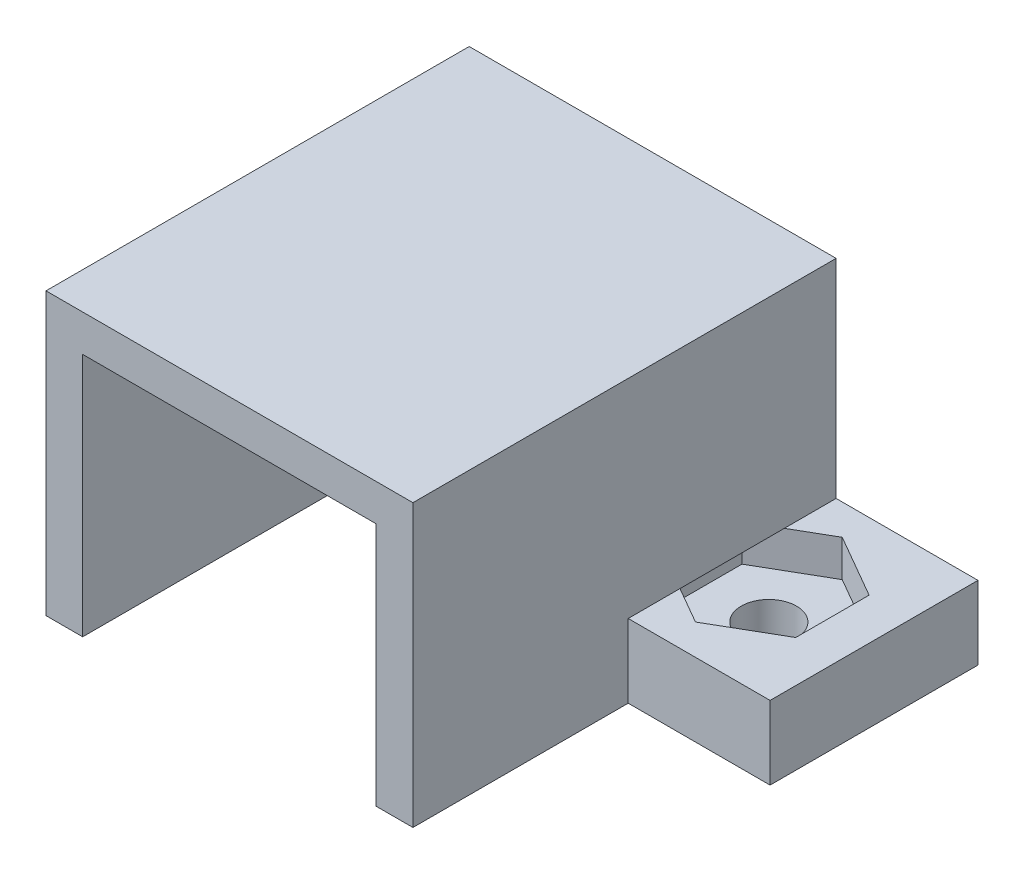
from build123d import *

# Parameters (mm, degrees)
BOSS_EXTRUDE4_DEPTH = 8.5
BOSS_EXTRUDE5_DEPTH = 8.8
CUT_EXTRUDE1_DEPTH  = 1.5
CUT_EXTRUDE2_REACH  = 35.269
SKETCH7_R           = 1.1303


with BuildPart() as part:
    # Sketch4 → Boss-Extrude4 (new body)
    with BuildSketch(Plane.XY):
        Polygon((0, 0), (0, 3), (5.8, 3), (5.8, 11.5), (20.8, 11.5), (20.8, 3), (26.6, 3), (26.6, 0), (19.3, 0), (19.3, 10), (7.3, 10), (7.3, 0), align=None)
    extrude(amount=BOSS_EXTRUDE4_DEPTH)

    # Sketch5 → Boss-Extrude5 (add)
    with BuildSketch(Plane.XY.offset(8.5)):
        Polygon((7.3, 0), (7.3, 10), (19.3, 10), (19.3, 0), (20.8, 0), (20.8, 11.5), (5.8, 11.5), (5.8, 0), align=None)
    extrude(amount=BOSS_EXTRUDE5_DEPTH)

    # Sketch6 → Cut-Extrude1 (cut)
    with BuildSketch(Plane(origin=(0, 3, 0), x_dir=(1, 0, 0), z_dir=(0, 1, 0))):
        Polygon((24.898076211, -5.75), (22.3, -7.25), (19.701923789, -5.75), (19.701923789, -2.75), (22.3, -1.25), (24.898076211, -2.75), align=None)
        Polygon((4.3, -7.25), (6.898076211, -5.75), (6.898076211, -2.75), (4.3, -1.25), (1.701923789, -2.75), (1.701923789, -5.75), align=None)
    extrude(amount=-CUT_EXTRUDE1_DEPTH, mode=Mode.SUBTRACT)

    # Sketch7 → Cut-Extrude2 (cut, up to next)
    with BuildSketch(Plane(origin=(0, 1.5, 0), x_dir=(1, 0, 0), z_dir=(0, 1, 0)), mode=Mode.PRIVATE) as cut_extrude2_sk1:
        with Locations(Location((4.3, -4.25, 0), (0, 0, 270))):
            Circle(SKETCH7_R)
    cut_extrude2_tool1 = extrude(cut_extrude2_sk1.sketch, amount=-CUT_EXTRUDE2_REACH, mode=Mode.PRIVATE) & part.part
    # Sketch7 → Cut-Extrude2 (cut, up to next)
    with BuildSketch(Plane(origin=(0, 1.5, 0), x_dir=(1, 0, 0), z_dir=(0, 1, 0)), mode=Mode.PRIVATE) as cut_extrude2_sk2:
        with Locations(Location((22.3, -4.25, 0), (0, 0, 270))):
            Circle(SKETCH7_R)
    cut_extrude2_tool2 = extrude(cut_extrude2_sk2.sketch, amount=-CUT_EXTRUDE2_REACH, mode=Mode.PRIVATE) & part.part
    add(cut_extrude2_tool1.solids().sort_by_distance((4.3, 1.5, 4.25))[0], mode=Mode.SUBTRACT)
    add(cut_extrude2_tool2.solids().sort_by_distance((22.3, 1.5, 4.25))[0], mode=Mode.SUBTRACT)


solid = part.part
